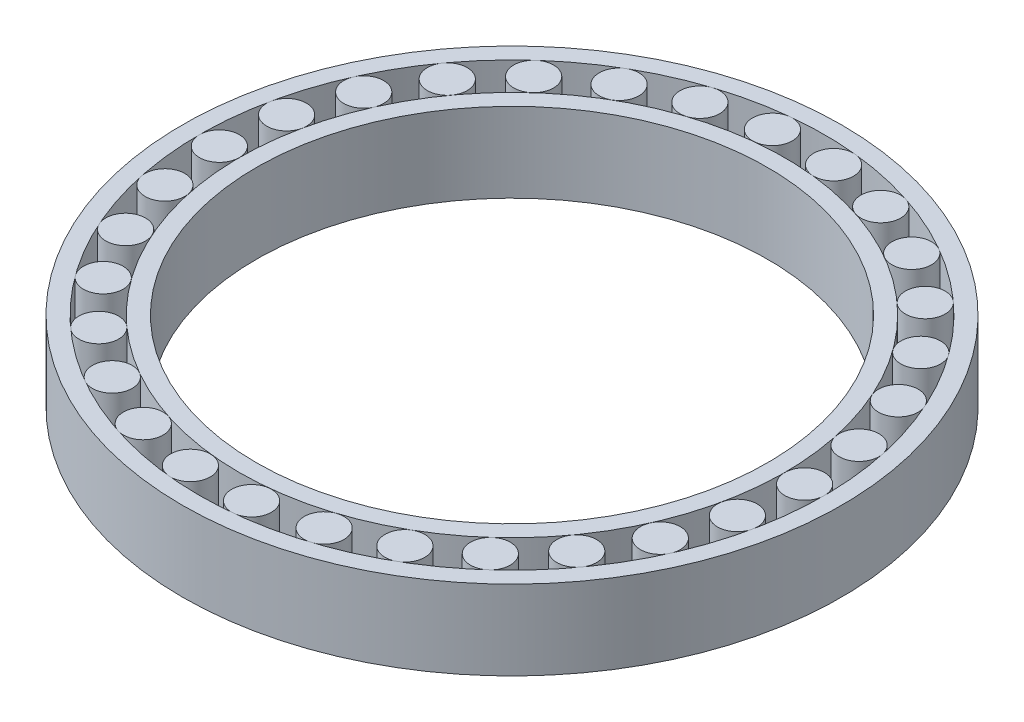
from build123d import *

# Parameters (mm, degrees)
SKETCH_1_R                = 29
SKETCH_1_R_2              = 27.5
EXTRUDE_1_DEPTH           = 7
SKETCH_2_R                = 24
SKETCH_2_R_2              = 22.5
EXTRUDE_2_DEPTH           = 7
SKETCH_3_R                = 1.75
EXTRUDE_3_DEPTH           = 7
PATTERN_CIRCULAR_27_COUNT = 30


with BuildPart() as part:
    # 草图1 → 凸台-拉伸1 (new body)
    with BuildSketch(Plane(origin=(0, 0, 0), x_dir=(1, 0, 0), z_dir=(0, 1, 0))):
        with Locations(Location((0, 0, 0), (0, 0, 270))):
            Circle(SKETCH_1_R)
        with Locations(Location((0, 0, 0), (0, 0, 270))):
            Circle(SKETCH_1_R_2, mode=Mode.SUBTRACT)
    extrude(amount=EXTRUDE_1_DEPTH)


with BuildPart() as body_2:
    # 草图2 → 凸台-拉伸2 (new body)
    with BuildSketch(Plane(origin=(0, 0, 0), x_dir=(1, 0, 0), z_dir=(0, 1, 0))):
        with Locations(Location((0, 0, 0), (0, 0, 270))):
            Circle(SKETCH_2_R)
        with Locations(Location((0, 0, 0), (0, 0, 270))):
            Circle(SKETCH_2_R_2, mode=Mode.SUBTRACT)
    extrude(amount=EXTRUDE_2_DEPTH)


with BuildPart() as body_3:
    # 草图3 → 凸台-拉伸3 (new body)
    with BuildSketch(Plane(origin=(0, 0, 0), x_dir=(1, 0, 0), z_dir=(0, 1, 0))):
        with Locations(Location((-25.75, 0, 0), (0, 0, 270))):
            Circle(SKETCH_3_R)
    extrude(amount=EXTRUDE_3_DEPTH)


with BuildPart() as pattern_circular_27_1:
    # 阵列(圆周)27: pattern copy
    add(body_3.part.rotate(Axis((0, 0, 0), (0, 1, 0)), 1 * 360 / PATTERN_CIRCULAR_27_COUNT))


with BuildPart() as pattern_circular_27_2:
    # 阵列(圆周)27: pattern copy
    add(body_3.part.rotate(Axis((0, 0, 0), (0, 1, 0)), 2 * 360 / PATTERN_CIRCULAR_27_COUNT))


with BuildPart() as pattern_circular_27_3:
    # 阵列(圆周)27: pattern copy
    add(body_3.part.rotate(Axis((0, 0, 0), (0, 1, 0)), 3 * 360 / PATTERN_CIRCULAR_27_COUNT))


with BuildPart() as pattern_circular_27_4:
    # 阵列(圆周)27: pattern copy
    add(body_3.part.rotate(Axis((0, 0, 0), (0, 1, 0)), 4 * 360 / PATTERN_CIRCULAR_27_COUNT))


with BuildPart() as pattern_circular_27_5:
    # 阵列(圆周)27: pattern copy
    add(body_3.part.rotate(Axis((0, 0, 0), (0, 1, 0)), 5 * 360 / PATTERN_CIRCULAR_27_COUNT))


with BuildPart() as pattern_circular_27_6:
    # 阵列(圆周)27: pattern copy
    add(body_3.part.rotate(Axis((0, 0, 0), (0, 1, 0)), 6 * 360 / PATTERN_CIRCULAR_27_COUNT))


with BuildPart() as pattern_circular_27_7:
    # 阵列(圆周)27: pattern copy
    add(body_3.part.rotate(Axis((0, 0, 0), (0, 1, 0)), 7 * 360 / PATTERN_CIRCULAR_27_COUNT))


with BuildPart() as pattern_circular_27_8:
    # 阵列(圆周)27: pattern copy
    add(body_3.part.rotate(Axis((0, 0, 0), (0, 1, 0)), 8 * 360 / PATTERN_CIRCULAR_27_COUNT))


with BuildPart() as pattern_circular_27_9:
    # 阵列(圆周)27: pattern copy
    add(body_3.part.rotate(Axis((0, 0, 0), (0, 1, 0)), 9 * 360 / PATTERN_CIRCULAR_27_COUNT))


with BuildPart() as pattern_circular_27_10:
    # 阵列(圆周)27: pattern copy
    add(body_3.part.rotate(Axis((0, 0, 0), (0, 1, 0)), 10 * 360 / PATTERN_CIRCULAR_27_COUNT))


with BuildPart() as pattern_circular_27_11:
    # 阵列(圆周)27: pattern copy
    add(body_3.part.rotate(Axis((0, 0, 0), (0, 1, 0)), 11 * 360 / PATTERN_CIRCULAR_27_COUNT))


with BuildPart() as pattern_circular_27_12:
    # 阵列(圆周)27: pattern copy
    add(body_3.part.rotate(Axis((0, 0, 0), (0, 1, 0)), 12 * 360 / PATTERN_CIRCULAR_27_COUNT))


with BuildPart() as pattern_circular_27_13:
    # 阵列(圆周)27: pattern copy
    add(body_3.part.rotate(Axis((0, 0, 0), (0, 1, 0)), 13 * 360 / PATTERN_CIRCULAR_27_COUNT))


with BuildPart() as pattern_circular_27_14:
    # 阵列(圆周)27: pattern copy
    add(body_3.part.rotate(Axis((0, 0, 0), (0, 1, 0)), 14 * 360 / PATTERN_CIRCULAR_27_COUNT))


with BuildPart() as pattern_circular_27_15:
    # 阵列(圆周)27: pattern copy
    add(body_3.part.rotate(Axis((0, 0, 0), (0, 1, 0)), 15 * 360 / PATTERN_CIRCULAR_27_COUNT))


with BuildPart() as pattern_circular_27_16:
    # 阵列(圆周)27: pattern copy
    add(body_3.part.rotate(Axis((0, 0, 0), (0, 1, 0)), 16 * 360 / PATTERN_CIRCULAR_27_COUNT))


with BuildPart() as pattern_circular_27_17:
    # 阵列(圆周)27: pattern copy
    add(body_3.part.rotate(Axis((0, 0, 0), (0, 1, 0)), 17 * 360 / PATTERN_CIRCULAR_27_COUNT))


with BuildPart() as pattern_circular_27_18:
    # 阵列(圆周)27: pattern copy
    add(body_3.part.rotate(Axis((0, 0, 0), (0, 1, 0)), 18 * 360 / PATTERN_CIRCULAR_27_COUNT))


with BuildPart() as pattern_circular_27_19:
    # 阵列(圆周)27: pattern copy
    add(body_3.part.rotate(Axis((0, 0, 0), (0, 1, 0)), 19 * 360 / PATTERN_CIRCULAR_27_COUNT))


with BuildPart() as pattern_circular_27_20:
    # 阵列(圆周)27: pattern copy
    add(body_3.part.rotate(Axis((0, 0, 0), (0, 1, 0)), 20 * 360 / PATTERN_CIRCULAR_27_COUNT))


with BuildPart() as pattern_circular_27_21:
    # 阵列(圆周)27: pattern copy
    add(body_3.part.rotate(Axis((0, 0, 0), (0, 1, 0)), 21 * 360 / PATTERN_CIRCULAR_27_COUNT))


with BuildPart() as pattern_circular_27_22:
    # 阵列(圆周)27: pattern copy
    add(body_3.part.rotate(Axis((0, 0, 0), (0, 1, 0)), 22 * 360 / PATTERN_CIRCULAR_27_COUNT))


with BuildPart() as pattern_circular_27_23:
    # 阵列(圆周)27: pattern copy
    add(body_3.part.rotate(Axis((0, 0, 0), (0, 1, 0)), 23 * 360 / PATTERN_CIRCULAR_27_COUNT))


with BuildPart() as pattern_circular_27_24:
    # 阵列(圆周)27: pattern copy
    add(body_3.part.rotate(Axis((0, 0, 0), (0, 1, 0)), 24 * 360 / PATTERN_CIRCULAR_27_COUNT))


with BuildPart() as pattern_circular_27_25:
    # 阵列(圆周)27: pattern copy
    add(body_3.part.rotate(Axis((0, 0, 0), (0, 1, 0)), 25 * 360 / PATTERN_CIRCULAR_27_COUNT))


with BuildPart() as pattern_circular_27_26:
    # 阵列(圆周)27: pattern copy
    add(body_3.part.rotate(Axis((0, 0, 0), (0, 1, 0)), 26 * 360 / PATTERN_CIRCULAR_27_COUNT))


with BuildPart() as pattern_circular_27_27:
    # 阵列(圆周)27: pattern copy
    add(body_3.part.rotate(Axis((0, 0, 0), (0, 1, 0)), 27 * 360 / PATTERN_CIRCULAR_27_COUNT))


with BuildPart() as pattern_circular_27_28:
    # 阵列(圆周)27: pattern copy
    add(body_3.part.rotate(Axis((0, 0, 0), (0, 1, 0)), 28 * 360 / PATTERN_CIRCULAR_27_COUNT))


with BuildPart() as pattern_circular_27_29:
    # 阵列(圆周)27: pattern copy
    add(body_3.part.rotate(Axis((0, 0, 0), (0, 1, 0)), 29 * 360 / PATTERN_CIRCULAR_27_COUNT))


solid = Compound([part.part, body_2.part, body_3.part, pattern_circular_27_1.part, pattern_circular_27_2.part, pattern_circular_27_3.part, pattern_circular_27_4.part, pattern_circular_27_5.part, pattern_circular_27_6.part, pattern_circular_27_7.part, pattern_circular_27_8.part, pattern_circular_27_9.part, pattern_circular_27_10.part, pattern_circular_27_11.part, pattern_circular_27_12.part, pattern_circular_27_13.part, pattern_circular_27_14.part, pattern_circular_27_15.part, pattern_circular_27_16.part, pattern_circular_27_17.part, pattern_circular_27_18.part, pattern_circular_27_19.part, pattern_circular_27_20.part, pattern_circular_27_21.part, pattern_circular_27_22.part, pattern_circular_27_23.part, pattern_circular_27_24.part, pattern_circular_27_25.part, pattern_circular_27_26.part, pattern_circular_27_27.part, pattern_circular_27_28.part, pattern_circular_27_29.part])
